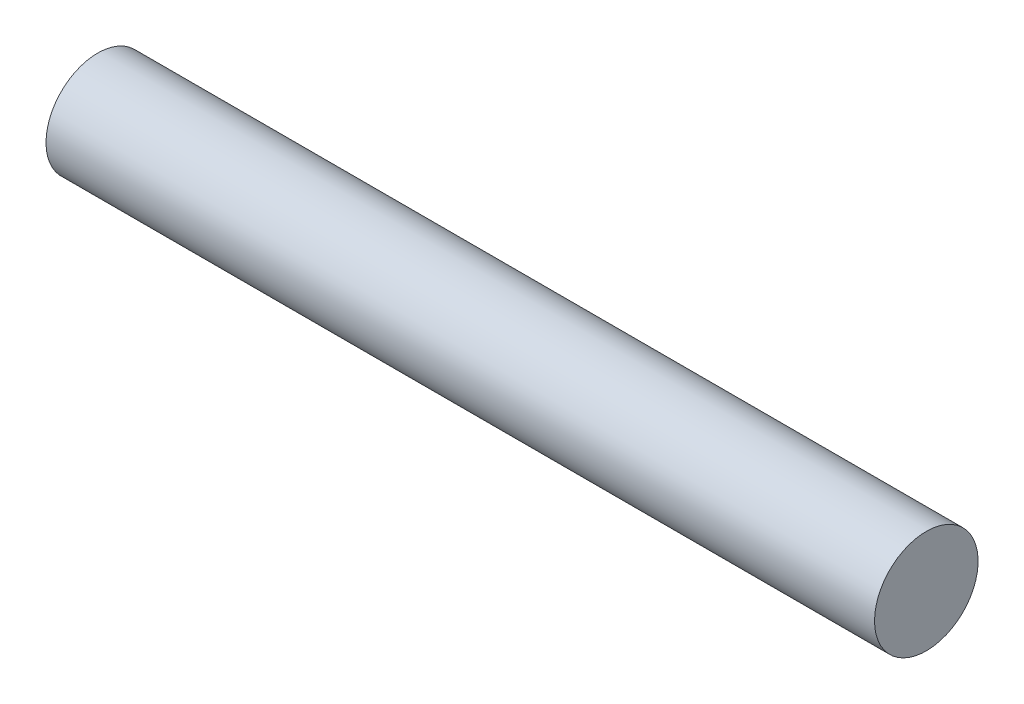
from build123d import *

# Parameters (mm, degrees)
SKETCH1_R           = 1.190625
BOSS_EXTRUDE1_DEPTH = 19.05


with BuildPart() as part:
    # Sketch1 → Boss-Extrude1 (new body)
    with BuildSketch(Plane(origin=(0, 0, 0), x_dir=(0, 0, -1), z_dir=(1, 0, 0))):
        with Locations(Location((0, 0, 0), (0, 0, 180))):
            Circle(SKETCH1_R)
    extrude(amount=BOSS_EXTRUDE1_DEPTH)


solid = part.part
